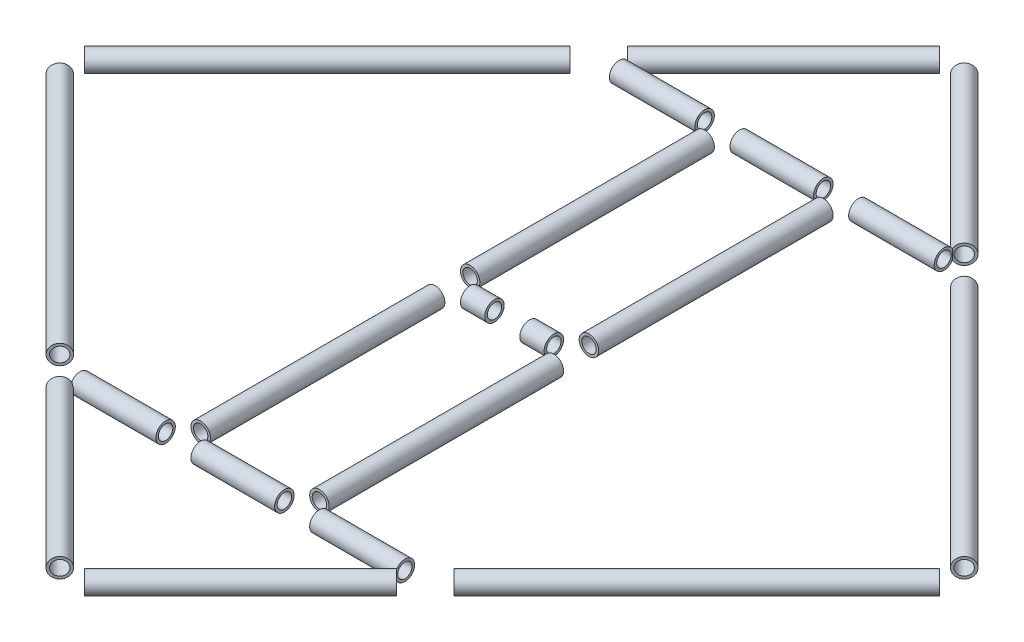
from build123d import *

# Parameters (mm, degrees)
SKETCH1_R                  = 10.668
SKETCH1_R_2                = 7.8994
PIPE_0_5_SCH_40_3_DEPTH    = 375.755287525
SKETCH1_ON_SEGMENT_2_R     = 10.668
SKETCH1_ON_SEGMENT_2_R_2   = 7.8994
PIPE_0_5_SCH_40_3_2_DEPTH  = 241.440712475
SKETCH1_ON_SEGMENT_3_R     = 10.668
SKETCH1_ON_SEGMENT_3_R_2   = 7.8994
PIPE_0_5_SCH_40_3_3_DEPTH  = 375.755287525
SKETCH1_ON_SEGMENT_4_R     = 10.668
SKETCH1_ON_SEGMENT_4_R_2   = 7.8994
PIPE_0_5_SCH_40_3_4_DEPTH  = 241.440712475
SKETCH1_ON_SEGMENT_5_R     = 10.668
SKETCH1_ON_SEGMENT_5_R_2   = 7.8994
PIPE_0_5_SCH_40_3_5_DEPTH  = 375.755287525
SKETCH1_ON_SEGMENT_6_R     = 10.668
SKETCH1_ON_SEGMENT_6_R_2   = 7.8994
PIPE_0_5_SCH_40_3_6_DEPTH  = 241.440712475
SKETCH1_ON_SEGMENT_7_R     = 10.668
SKETCH1_ON_SEGMENT_7_R_2   = 7.8994
PIPE_0_5_SCH_40_3_7_DEPTH  = 241.440712475
SKETCH1_ON_SEGMENT_8_R     = 10.668
SKETCH1_ON_SEGMENT_8_R_2   = 7.8994
PIPE_0_5_SCH_40_3_8_DEPTH  = 375.755287525
SKETCH1_ON_SEGMENT_9_R     = 10.668
SKETCH1_ON_SEGMENT_9_R_2   = 7.8994
PIPE_0_5_SCH_40_3_9_DEPTH  = 256.620746831
SKETCH1_ON_SEGMENT_10_R    = 10.668
SKETCH1_ON_SEGMENT_10_R_2  = 7.8994
PIPE_0_5_SCH_40_3_10_DEPTH = 256.620746831
SKETCH1_ON_SEGMENT_11_R    = 10.668
SKETCH1_ON_SEGMENT_11_R_2  = 7.8994
PIPE_0_5_SCH_40_3_11_DEPTH = 256.620746831
SKETCH1_ON_SEGMENT_12_R    = 10.668
SKETCH1_ON_SEGMENT_12_R_2  = 7.8994
PIPE_0_5_SCH_40_3_12_DEPTH = 256.620746831
SKETCH1_ON_SEGMENT_13_R    = 10.668
SKETCH1_ON_SEGMENT_13_R_2  = 7.8994
PIPE_0_5_SCH_40_3_13_DEPTH = 93.598
SKETCH1_ON_SEGMENT_14_R    = 10.668
SKETCH1_ON_SEGMENT_14_R_2  = 7.8994
PIPE_0_5_SCH_40_3_14_DEPTH = 91.646
SKETCH1_ON_SEGMENT_15_R    = 10.668
SKETCH1_ON_SEGMENT_15_R_2  = 7.8994
PIPE_0_5_SCH_40_3_15_DEPTH = 93.598
SKETCH1_ON_SEGMENT_16_R    = 10.668
SKETCH1_ON_SEGMENT_16_R_2  = 7.8994
PIPE_0_5_SCH_40_3_16_DEPTH = 26.646
SKETCH1_ON_SEGMENT_17_R    = 10.668
SKETCH1_ON_SEGMENT_17_R_2  = 7.8994
PIPE_0_5_SCH_40_3_17_DEPTH = 26.646
SKETCH1_ON_SEGMENT_18_R    = 10.668
SKETCH1_ON_SEGMENT_18_R_2  = 7.8994
PIPE_0_5_SCH_40_3_18_DEPTH = 93.598
SKETCH1_ON_SEGMENT_19_R    = 10.668
SKETCH1_ON_SEGMENT_19_R_2  = 7.8994
PIPE_0_5_SCH_40_3_19_DEPTH = 91.646
SKETCH1_ON_SEGMENT_20_R    = 10.668
SKETCH1_ON_SEGMENT_20_R_2  = 7.8994
PIPE_0_5_SCH_40_3_20_DEPTH = 93.598


with BuildPart() as part:
    # Sketch1 → Pipe 0.5 SCH 40(3) (new body)
    with BuildSketch(Plane(origin=(-215.715448212, 0, -279.259298619), x_dir=(0.7071067811865476, 0, 0.7071067811865475), z_dir=(-0.7071067811865475, 0, 0.7071067811865476))):
        Circle(SKETCH1_R)
        Circle(SKETCH1_R_2, mode=Mode.SUBTRACT)
    extrude(amount=PIPE_0_5_SCH_40_3_DEPTH)


with BuildPart() as body_2:
    # Sketch1 on segment 2 (carried to segment 2) → Pipe 0.5 SCH 40_3 2 (new body)
    with BuildSketch(Plane(origin=(-13.560186743, 0, -481.414560088), x_dir=(0.707106781, 0, 0.707106781), z_dir=(-0.707106781, 0, 0.707106781))):
        Circle(SKETCH1_ON_SEGMENT_2_R)
        Circle(SKETCH1_ON_SEGMENT_2_R_2, mode=Mode.SUBTRACT)
    extrude(amount=PIPE_0_5_SCH_40_3_2_DEPTH)


with BuildPart() as body_3:
    # Sketch1 on segment 3 (carried to segment 3) → Pipe 0.5 SCH 40_3 3 (new body)
    with BuildSketch(Plane(origin=(481.414560088, 0, 13.560186743), x_dir=(0.707106781, 0, 0.707106781), z_dir=(-0.707106781, 0, 0.707106781))):
        Circle(SKETCH1_ON_SEGMENT_3_R)
        Circle(SKETCH1_ON_SEGMENT_3_R_2, mode=Mode.SUBTRACT)
    extrude(amount=PIPE_0_5_SCH_40_3_3_DEPTH)


with BuildPart() as body_4:
    # Sketch1 on segment 4 (carried to segment 4) → Pipe 0.5 SCH 40_3 4 (new body)
    with BuildSketch(Plane(origin=(184.284551788, 0, 310.690195042), x_dir=(0.707106781, 0, 0.707106781), z_dir=(-0.707106781, 0, 0.707106781))):
        Circle(SKETCH1_ON_SEGMENT_4_R)
        Circle(SKETCH1_ON_SEGMENT_4_R_2, mode=Mode.SUBTRACT)
    extrude(amount=PIPE_0_5_SCH_40_3_4_DEPTH)


with BuildPart() as body_5:
    # Sketch1 on segment 5 (carried to segment 5) → Pipe 0.5 SCH 40_3 5 (new body)
    with BuildSketch(Plane(origin=(-215.715448212, 0, 279.259298619), x_dir=(-0.707106781, 0, 0.707106781), z_dir=(-0.707106781, 0, -0.707106781))):
        Circle(SKETCH1_ON_SEGMENT_5_R)
        Circle(SKETCH1_ON_SEGMENT_5_R_2, mode=Mode.SUBTRACT)
    extrude(amount=PIPE_0_5_SCH_40_3_5_DEPTH)


with BuildPart() as body_6:
    # Sketch1 on segment 6 (carried to segment 6) → Pipe 0.5 SCH 40_3 6 (new body)
    with BuildSketch(Plane(origin=(-13.560186743, 0, 481.414560088), x_dir=(-0.707106781, 0, 0.707106781), z_dir=(-0.707106781, 0, -0.707106781))):
        Circle(SKETCH1_ON_SEGMENT_6_R)
        Circle(SKETCH1_ON_SEGMENT_6_R_2, mode=Mode.SUBTRACT)
    extrude(amount=PIPE_0_5_SCH_40_3_6_DEPTH)


with BuildPart() as body_7:
    # Sketch1 on segment 7 (carried to segment 7) → Pipe 0.5 SCH 40_3 7 (new body)
    with BuildSketch(Plane(origin=(13.560186743, 0, -481.414560088), x_dir=(0.707106781, 0, -0.707106781), z_dir=(0.707106781, 0, 0.707106781))):
        Circle(SKETCH1_ON_SEGMENT_7_R)
        Circle(SKETCH1_ON_SEGMENT_7_R_2, mode=Mode.SUBTRACT)
    extrude(amount=PIPE_0_5_SCH_40_3_7_DEPTH)


with BuildPart() as body_8:
    # Sketch1 on segment 8 (carried to segment 8) → Pipe 0.5 SCH 40_3 8 (new body)
    with BuildSketch(Plane(origin=(215.715448212, 0, -279.259298619), x_dir=(0.707106781, 0, -0.707106781), z_dir=(0.707106781, 0, 0.707106781))):
        Circle(SKETCH1_ON_SEGMENT_8_R)
        Circle(SKETCH1_ON_SEGMENT_8_R_2, mode=Mode.SUBTRACT)
    extrude(amount=PIPE_0_5_SCH_40_3_8_DEPTH)


with BuildPart() as body_9:
    # Sketch1 on segment 9 (carried to segment 9) → Pipe 0.5 SCH 40_3 9 (new body)
    with BuildSketch(Plane(origin=(-65, 0, -275.797746831), x_dir=(1, 0, 0), z_dir=(0, 0, 1))):
        Circle(SKETCH1_ON_SEGMENT_9_R)
        Circle(SKETCH1_ON_SEGMENT_9_R_2, mode=Mode.SUBTRACT)
    extrude(amount=PIPE_0_5_SCH_40_3_9_DEPTH)


with BuildPart() as body_10:
    # Sketch1 on segment 10 (carried to segment 10) → Pipe 0.5 SCH 40_3 10 (new body)
    with BuildSketch(Plane(origin=(65, 0, -275.797746831), x_dir=(1, 0, 0), z_dir=(0, 0, 1))):
        Circle(SKETCH1_ON_SEGMENT_10_R)
        Circle(SKETCH1_ON_SEGMENT_10_R_2, mode=Mode.SUBTRACT)
    extrude(amount=PIPE_0_5_SCH_40_3_10_DEPTH)


with BuildPart() as body_11:
    # Sketch1 on segment 11 (carried to segment 11) → Pipe 0.5 SCH 40_3 11 (new body)
    with BuildSketch(Plane(origin=(-65, 0, 275.797746831), x_dir=(-1, 0, 0), z_dir=(0, 0, -1))):
        Circle(SKETCH1_ON_SEGMENT_11_R)
        Circle(SKETCH1_ON_SEGMENT_11_R_2, mode=Mode.SUBTRACT)
    extrude(amount=PIPE_0_5_SCH_40_3_11_DEPTH)


with BuildPart() as body_12:
    # Sketch1 on segment 12 (carried to segment 12) → Pipe 0.5 SCH 40_3 12 (new body)
    with BuildSketch(Plane(origin=(65, 0, 275.797746831), x_dir=(-1, 0, 0), z_dir=(0, 0, -1))):
        Circle(SKETCH1_ON_SEGMENT_12_R)
        Circle(SKETCH1_ON_SEGMENT_12_R_2, mode=Mode.SUBTRACT)
    extrude(amount=PIPE_0_5_SCH_40_3_12_DEPTH)


with BuildPart() as body_13:
    # Sketch1 on segment 13 (carried to segment 13) → Pipe 0.5 SCH 40_3 13 (new body)
    with BuildSketch(Plane(origin=(-84.177, 0, 294.974746831), x_dir=(0, 0, 1), z_dir=(-1, 0, 0))):
        Circle(SKETCH1_ON_SEGMENT_13_R)
        Circle(SKETCH1_ON_SEGMENT_13_R_2, mode=Mode.SUBTRACT)
    extrude(amount=PIPE_0_5_SCH_40_3_13_DEPTH)


with BuildPart() as body_14:
    # Sketch1 on segment 14 (carried to segment 14) → Pipe 0.5 SCH 40_3 14 (new body)
    with BuildSketch(Plane(origin=(-45.823, 0, 294.974746831), x_dir=(0, 0, -1), z_dir=(1, 0, 0))):
        Circle(SKETCH1_ON_SEGMENT_14_R)
        Circle(SKETCH1_ON_SEGMENT_14_R_2, mode=Mode.SUBTRACT)
    extrude(amount=PIPE_0_5_SCH_40_3_14_DEPTH)


with BuildPart() as body_15:
    # Sketch1 on segment 15 (carried to segment 15) → Pipe 0.5 SCH 40_3 15 (new body)
    with BuildSketch(Plane(origin=(84.177, 0, 294.974746831), x_dir=(0, 0, -1), z_dir=(1, 0, 0))):
        Circle(SKETCH1_ON_SEGMENT_15_R)
        Circle(SKETCH1_ON_SEGMENT_15_R_2, mode=Mode.SUBTRACT)
    extrude(amount=PIPE_0_5_SCH_40_3_15_DEPTH)


with BuildPart() as body_16:
    # Sketch1 on segment 16 (carried to segment 16) → Pipe 0.5 SCH 40_3 16 (new body)
    with BuildSketch(Plane.ZY.offset(19.177)):
        Circle(SKETCH1_ON_SEGMENT_16_R)
        Circle(SKETCH1_ON_SEGMENT_16_R_2, mode=Mode.SUBTRACT)
    extrude(amount=PIPE_0_5_SCH_40_3_16_DEPTH)


with BuildPart() as body_17:
    # Sketch1 on segment 17 (carried to segment 17) → Pipe 0.5 SCH 40_3 17 (new body)
    with BuildSketch(Plane(origin=(19.177, 0, 0), x_dir=(0, 0, -1), z_dir=(1, 0, 0))):
        Circle(SKETCH1_ON_SEGMENT_17_R)
        Circle(SKETCH1_ON_SEGMENT_17_R_2, mode=Mode.SUBTRACT)
    extrude(amount=PIPE_0_5_SCH_40_3_17_DEPTH)


with BuildPart() as body_18:
    # Sketch1 on segment 18 (carried to segment 18) → Pipe 0.5 SCH 40_3 18 (new body)
    with BuildSketch(Plane(origin=(-84.177, 0, -294.974746831), x_dir=(0, 0, 1), z_dir=(-1, 0, 0))):
        Circle(SKETCH1_ON_SEGMENT_18_R)
        Circle(SKETCH1_ON_SEGMENT_18_R_2, mode=Mode.SUBTRACT)
    extrude(amount=PIPE_0_5_SCH_40_3_18_DEPTH)


with BuildPart() as body_19:
    # Sketch1 on segment 19 (carried to segment 19) → Pipe 0.5 SCH 40_3 19 (new body)
    with BuildSketch(Plane(origin=(-45.823, 0, -294.974746831), x_dir=(0, 0, -1), z_dir=(1, 0, 0))):
        Circle(SKETCH1_ON_SEGMENT_19_R)
        Circle(SKETCH1_ON_SEGMENT_19_R_2, mode=Mode.SUBTRACT)
    extrude(amount=PIPE_0_5_SCH_40_3_19_DEPTH)


with BuildPart() as body_20:
    # Sketch1 on segment 20 (carried to segment 20) → Pipe 0.5 SCH 40_3 20 (new body)
    with BuildSketch(Plane(origin=(84.177, 0, -294.974746831), x_dir=(0, 0, -1), z_dir=(1, 0, 0))):
        Circle(SKETCH1_ON_SEGMENT_20_R)
        Circle(SKETCH1_ON_SEGMENT_20_R_2, mode=Mode.SUBTRACT)
    extrude(amount=PIPE_0_5_SCH_40_3_20_DEPTH)


solid = Compound([part.part, body_2.part, body_3.part, body_4.part, body_5.part, body_6.part, body_7.part, body_8.part, body_9.part, body_10.part, body_11.part, body_12.part, body_13.part, body_14.part, body_15.part, body_16.part, body_17.part, body_18.part, body_19.part, body_20.part])
